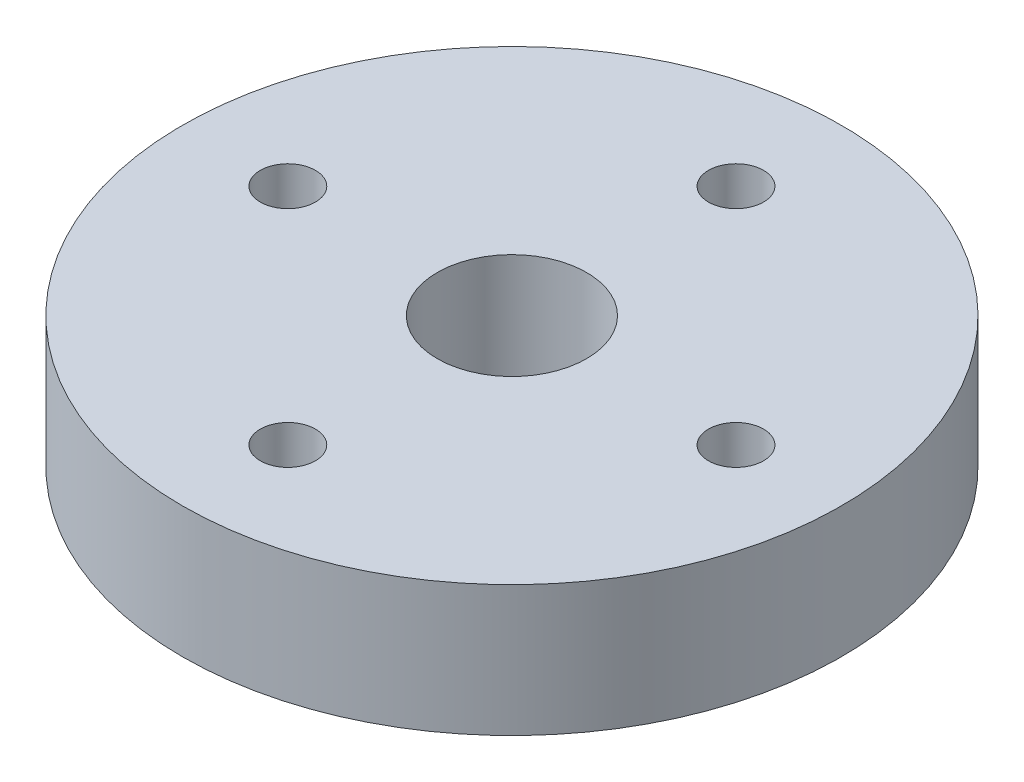
from build123d import *

# Parameters (mm, degrees)
SKETCH1_R           = 17.65
SKETCH1_R_2         = 4
SKETCH1_R_3         = 1.475
BOSS_EXTRUDE1_DEPTH = 7


with BuildPart() as part:
    # Sketch1 → Boss-Extrude1 (new body)
    with BuildSketch(Plane(origin=(0, 0, 0), x_dir=(1, 0, 0), z_dir=(0, 1, 0))):
        with Locations(Location((0, 0, 0), (0, 0, 270))):
            Circle(SKETCH1_R)
        with Locations(Location((0, 0, 0), (0, 0, 270))):
            Circle(SKETCH1_R_2, mode=Mode.SUBTRACT)
        with Locations(Location((0, 12, 0), (0, 0, 270))):
            Circle(SKETCH1_R_3, mode=Mode.SUBTRACT)
        with Locations(Location((-12, 0, 0), (0, 0, 270))):
            Circle(SKETCH1_R_3, mode=Mode.SUBTRACT)
        with Locations(Location((12, 0, 0), (0, 0, 90))):
            Circle(SKETCH1_R_3, mode=Mode.SUBTRACT)
        with Locations(Location((0, -12, 0), (0, 0, 90))):
            Circle(SKETCH1_R_3, mode=Mode.SUBTRACT)
    extrude(amount=BOSS_EXTRUDE1_DEPTH)


solid = part.part
